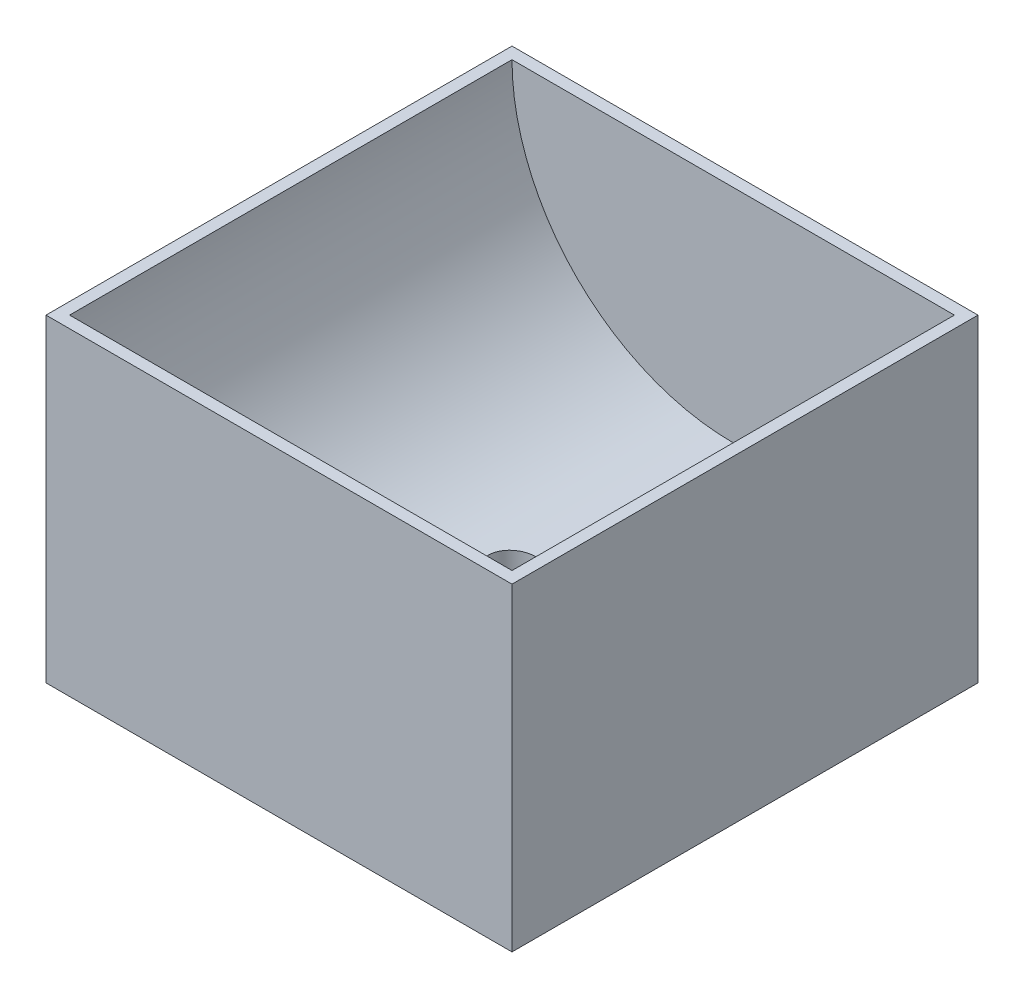
from build123d import *

# Parameters (mm, degrees)
BOSS_EXTRUDE1_DEPTH = 37.5
SKETCH2_W           = 79
SKETCH2_H           = 40.5
BOSS_EXTRUDE2_DEPTH = 2
SKETCH3_W           = 79
SKETCH3_H           = 40.5
BOSS_EXTRUDE3_DEPTH = 2
SKETCH4_R           = 4.05
CUT_EXTRUDE2_DEPTH  = 69.998188382
SKETCH5_W           = 79
SKETCH5_H           = 79
BOSS_EXTRUDE4_DEPTH = 13.5
SKETCH6_R           = 8
CUT_EXTRUDE3_DEPTH  = 7


with BuildPart() as part:
    # Sketch1 → Boss-Extrude1 (new, symmetric)
    with BuildSketch(Plane.XY):
        with BuildLine():
            Line((37.5, 0), (39.5, 0))
            Line((39.5, 0), (39.5, -40.5))
            Line((39.5, -40.5), (-39.5, -40.5))
            Line((-39.5, -40.5), (-39.5, 0))
            Line((-39.5, 0), (-37.5, 0))
            ThreePointArc((-37.5, 0), (0, -37.5), (37.5, 0))
        make_face()
    extrude(amount=BOSS_EXTRUDE1_DEPTH, both=True)

    # Sketch2 → Boss-Extrude2 (add)
    with BuildSketch(Plane.XY.offset(37.5)):
        with Locations((0, -20.25)):
            Rectangle(SKETCH2_W, SKETCH2_H)
    extrude(amount=BOSS_EXTRUDE2_DEPTH)

    # Sketch3 → Boss-Extrude3 (add)
    with BuildSketch(Plane(origin=(0, 0, -37.5), x_dir=(-1, 0, 0), z_dir=(0, 0, -1))):
        with Locations((0, -20.25)):
            Rectangle(SKETCH3_W, SKETCH3_H)
    extrude(amount=BOSS_EXTRUDE3_DEPTH)

    # Sketch4 → Cut-Extrude2 (cut, through all)
    with BuildSketch(Plane.XZ.offset(40.5)):
        with Locations(Location((0, 0, 0), (0, 0, 270))):
            Circle(SKETCH4_R)
    extrude(amount=-CUT_EXTRUDE2_DEPTH, mode=Mode.SUBTRACT)

    # Sketch5 → Boss-Extrude4 (add)
    with BuildSketch(Plane.XZ.offset(40.5)):
        Rectangle(SKETCH5_W, SKETCH5_H)
        Polygon((-7.505553499, 0), (-3.75277675, -6.5), (3.75277675, -6.5), (7.505553499, 0), (3.75277675, 6.5), (-3.75277675, 6.5), align=None, mode=Mode.SUBTRACT)
    extrude(amount=BOSS_EXTRUDE4_DEPTH)

    # Sketch6 → Cut-Extrude3 (cut)
    with BuildSketch(Plane.XZ.offset(54)):
        with Locations(Location((0, 0, 0), (0, 0, 270))):
            Circle(SKETCH6_R)
    extrude(amount=-CUT_EXTRUDE3_DEPTH, mode=Mode.SUBTRACT)


solid = part.part
